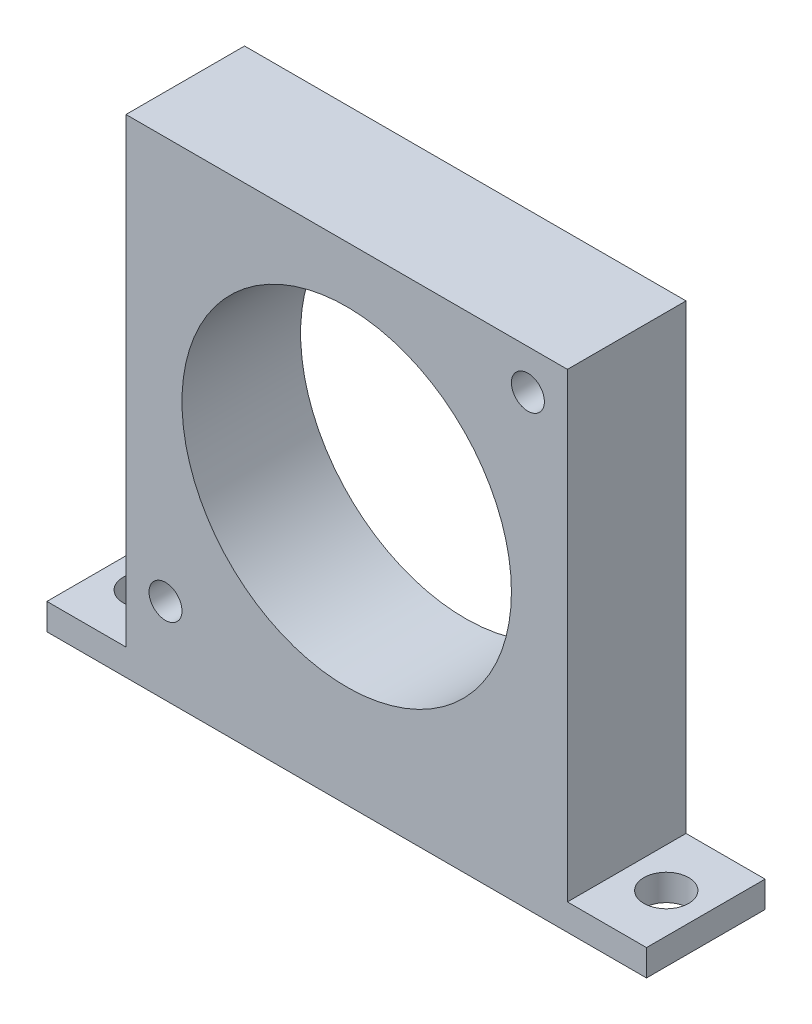
from build123d import *

# Parameters (mm, degrees)
BOSS_EXTRUDE1_DEPTH    = 9
M3X0_5_TAPPED_HOLE1_D  = 2.5
M3_CLEARANCE_HOLE2_D   = 3.4
F_25_0MM_DOWEL_HOLE1_D = 25


with BuildPart() as part:
    # Sketch1 → Boss-Extrude1 (new body)
    with BuildSketch(Plane.XY):
        Polygon((0, 0), (45.5, 0), (45.5, 2), (39.5, 2), (39.5, 37), (6, 37), (6, 2), (0, 2), align=None)
    extrude(amount=BOSS_EXTRUDE1_DEPTH)

    # M3x0.5 Tapped Hole1 (through all)
    with Locations(Plane(origin=(36.5, 34, 9), x_dir=(1, 0, 0), z_dir=(0, 0, 1))):
        with Locations((0, 0), (-27.5, -27.5)):
            Hole(M3X0_5_TAPPED_HOLE1_D / 2)

    # M3 Clearance Hole2 (through all)
    with Locations(Plane(origin=(42.5, 2, 4.5), x_dir=(0, 0, 1), z_dir=(0, 1, 0))):
        with Locations((0, 0), (0, -39.5)):
            Hole(M3_CLEARANCE_HOLE2_D / 2)

    # Ø25.0mm Dowel Hole1 (through all)
    with Locations(Plane.XY.offset(9)):
        with Locations((22.75, 20.25)):
            Hole(F_25_0MM_DOWEL_HOLE1_D / 2)


solid = part.part
